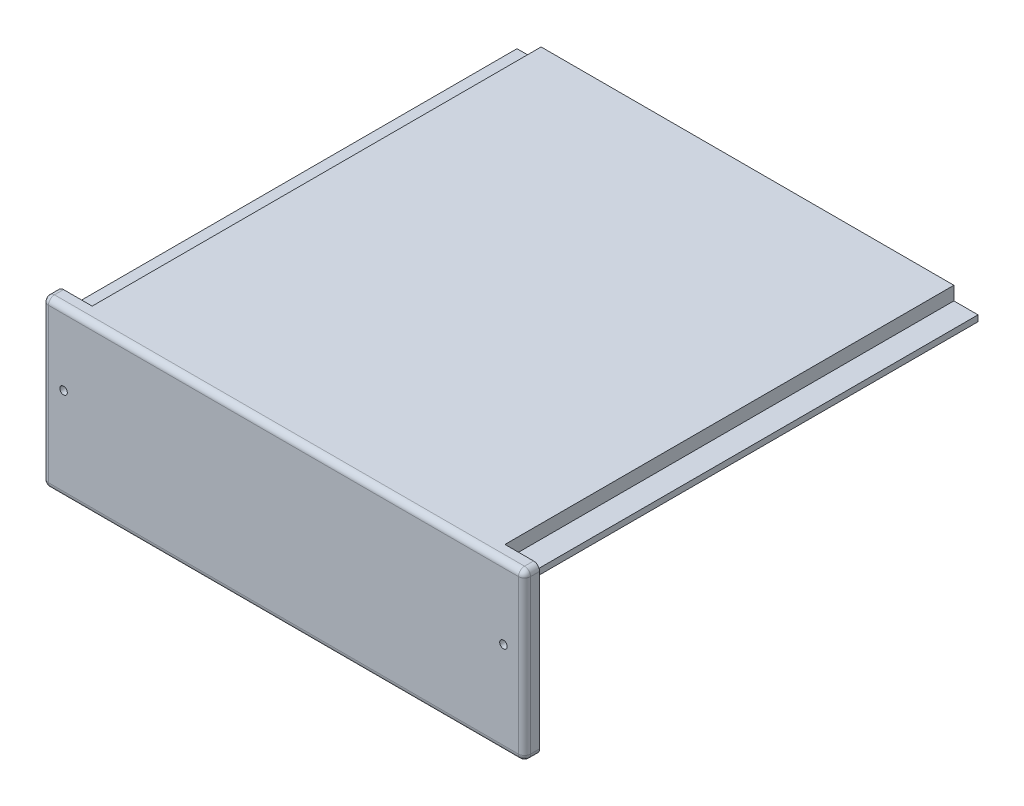
from build123d import *

# Parameters (mm, degrees)
SKETCH1_W           = 160
SKETCH1_H           = 55
BOSS_EXTRUDE1_DEPTH = 5
SKETCH4_W           = 138
SKETCH4_H           = 4
BOSS_EXTRUDE3_DEPTH = 4
FILLET1_R           = 2
CUT_EXTRUDE1_REACH  = 99.211
SKETCH10_R          = 1.25
BOSS_EXTRUDE4_DEPTH = 149


with BuildPart() as part:
    # Sketch1 → Boss-Extrude1 (new body)
    with BuildSketch(Plane.XY):
        with Locations((0, 27.5)):
            Rectangle(SKETCH1_W, SKETCH1_H)
    extrude(amount=BOSS_EXTRUDE1_DEPTH)

    # Sketch4 → Boss-Extrude3 (add)
    with BuildSketch(Plane(origin=(0, 0, 0), x_dir=(-1, 0, 0), z_dir=(0, 0, -1))):
        with Locations((0, 15)):
            Rectangle(SKETCH4_W, SKETCH4_H)
        with Locations((0, 8)):
            Rectangle(SKETCH4_W, SKETCH4_H)
    extrude(amount=BOSS_EXTRUDE3_DEPTH)

    # Fillet1
    fillet1_edges = [part.edges().sort_by_distance(p)[0] for p in [
        (-80, 27.5, 5),
        (0, 0, 5),
        (80, 27.5, 5),
        (0, 55, 5),
        (80, 0, 2.5),
        (-80, 0, 2.5),
        (-80, 55, 2.5),
        (80, 55, 2.5),
    ]]
    fillet(fillet1_edges, radius=FILLET1_R)

    # Sketch10 → Cut-Extrude1 (cut, up to next)
    with BuildSketch(Plane(origin=(0, 0, 0), x_dir=(-1, 0, 0), z_dir=(0, 0, -1)), mode=Mode.PRIVATE) as cut_extrude1_sk1:
        with Locations((-73, 31)):
            Circle(SKETCH10_R)
    cut_extrude1_tool1 = extrude(cut_extrude1_sk1.sketch, amount=-CUT_EXTRUDE1_REACH, mode=Mode.PRIVATE) & part.part
    cut_extrude1 = cut_extrude1_tool1.solids().sort_by_distance((73, 31, 0))[0]
    add(cut_extrude1, mode=Mode.SUBTRACT)

    # Mirror1: Cut-Extrude1 across plane
    add(cut_extrude1.mirror(Plane(origin=(0, 0, 0), x_dir=(0, 0, 1), z_dir=(1, 0, 0))), mode=Mode.SUBTRACT)

    # Sketch13 → Boss-Extrude4 (add)
    with BuildSketch(Plane(origin=(0, 0, 0), x_dir=(-1, 0, 0), z_dir=(0, 0, -1))):
        Polygon((-68.5, 55), (-68.5, 50.5), (-76.5, 50.5), (-76.5, 48.5), (-68.5, 48.5), (-68.5, 45), (68.5, 45), (68.5, 48.5), (76.5, 48.5), (76.5, 50.5), (68.5, 50.5), (68.5, 55), align=None)
    extrude(amount=BOSS_EXTRUDE4_DEPTH)


solid = part.part
